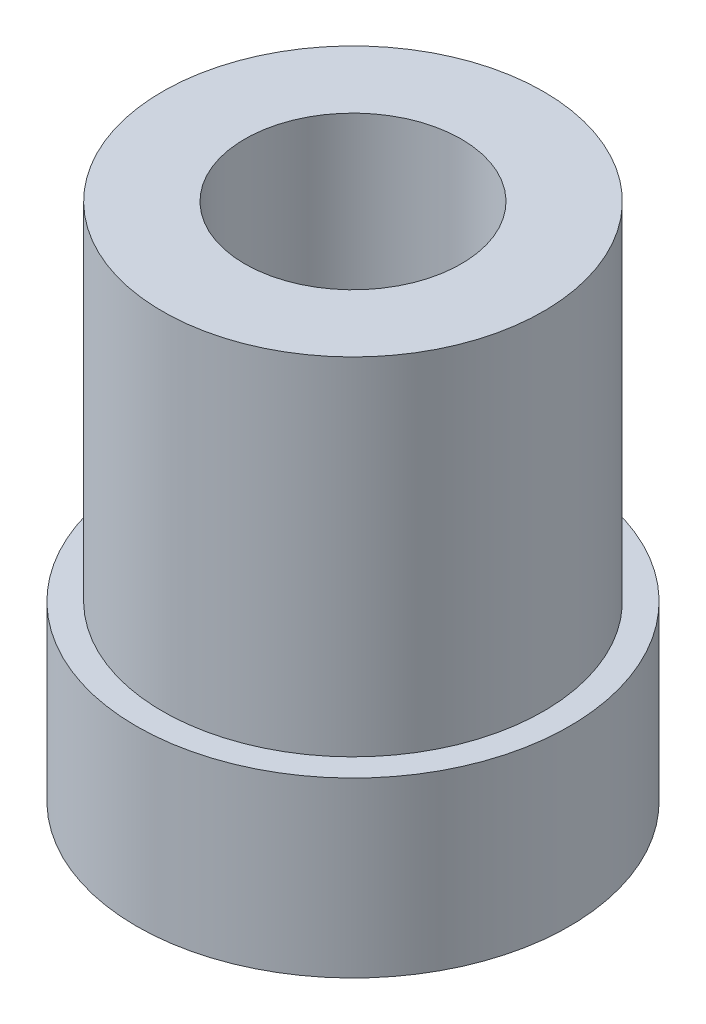
from build123d import *

# Parameters (mm, degrees)
SKETCH1_R           = 6.985
SKETCH1_R_2         = 3.96875
BOSS_EXTRUDE1_DEPTH = 19.05
SKETCH2_3_R         = 7.9375
SKETCH2_3_R_2       = 6.985
BOSS_EXTRUDE2_DEPTH = 6.35


with BuildPart() as part:
    # Sketch1 → Boss-Extrude1 (new body)
    with BuildSketch(Plane(origin=(0, 0, 0), x_dir=(1, 0, 0), z_dir=(0, 1, 0))):
        Circle(SKETCH1_R)
        Circle(SKETCH1_R_2, mode=Mode.SUBTRACT)
    extrude(amount=BOSS_EXTRUDE1_DEPTH)

    # Sketch2<3> → Boss-Extrude2 (add)
    with BuildSketch(Plane(origin=(0, 0, 0), x_dir=(1, 0, 0), z_dir=(0, 1, 0))):
        Circle(SKETCH2_3_R)
        Circle(SKETCH2_3_R_2, mode=Mode.SUBTRACT)
    extrude(amount=BOSS_EXTRUDE2_DEPTH)


solid = part.part
